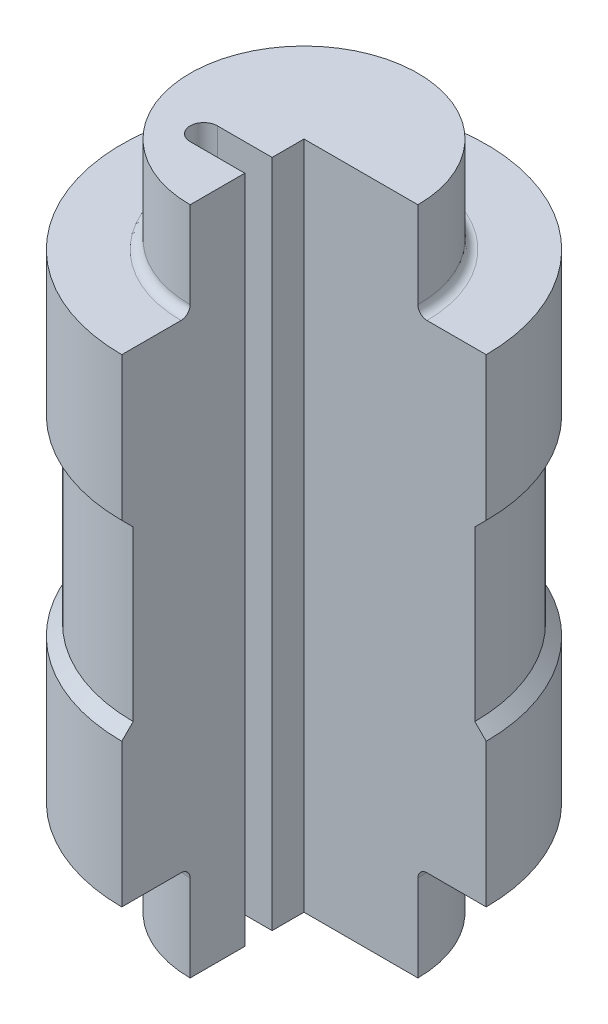
from build123d import *

# Parameters (mm, degrees)
SKETCH1_R           = 40
BOSS_EXTRUDE1_DEPTH = 105
SKETCH2_R           = 25
BOSS_EXTRUDE2_DEPTH = 21
BOSS_EXTRUDE3_START = 21
SKETCH3_R           = 25
BOSS_EXTRUDE3_DEPTH = 21
FILLET1_R           = 2
SKETCH5_W           = 44.625260544
SKETCH5_H           = 44.184879684
CUT_EXTRUDE1_DEPTH  = 158.508729917
CUT_EXTRUDE2_DEPTH  = 158.508729917


with BuildPart() as part:
    # Sketch1 → Boss-Extrude1 (new body)
    with BuildSketch(Plane(origin=(0, 0, 0), x_dir=(1, 0, 0), z_dir=(0, 1, 0))):
        with Locations(Location((0, 0, 0), (0, 0, 270))):
            Circle(SKETCH1_R)
    extrude(amount=BOSS_EXTRUDE1_DEPTH)

    # Sketch2 → Boss-Extrude2 (add)
    with BuildSketch(Plane(origin=(0, 105, 0), x_dir=(1, 0, 0), z_dir=(0, 1, 0))):
        with Locations(Location((0, 0, 0), (0, 0, 90))):
            Circle(SKETCH2_R)
    extrude(amount=BOSS_EXTRUDE2_DEPTH)

    # Sketch3 → Boss-Extrude3 (add)
    with BuildSketch(Plane(origin=(0, 0, 0), x_dir=(-1, 0, 0), z_dir=(0, -1, 0)).offset(BOSS_EXTRUDE3_START)):
        with Locations(Location((0, 0, 0), (0, 0, 90))):
            Circle(SKETCH3_R)
    extrude(amount=-BOSS_EXTRUDE3_DEPTH)

    # Fillet1
    fillet1_edges = [part.edges().sort_by_distance(p)[0] for p in [
        (0, 0, 25),
        (0, 105, 25),
    ]]
    fillet(fillet1_edges, radius=FILLET1_R)

    # Sketch4 → Cut-Revolve1 (revolve, cut)
    with BuildSketch(Plane(origin=(0, 0, 0), x_dir=(0, 0, -1), z_dir=(1, 0, 0)), mode=Mode.PRIVATE) as cut_revolve1_sk:
        Polygon((40, 73.5), (37.5, 71), (37.5, 34), (40, 31.5), align=None)
    revolve(cut_revolve1_sk.sketch.rotate(Axis((0, 105, 0), (0, -1, 0)), 180), axis=Axis((0, 105, 0), (0, -1, 0)), mode=Mode.SUBTRACT)

    # Sketch5 → Cut-Extrude1 (cut, through all)
    with BuildSketch(Plane(origin=(0, -21, 0), x_dir=(-1, 0, 0), z_dir=(0, -1, 0))):
        with Locations((-22.312630272, -22.092439842)):
            Rectangle(SKETCH5_W, SKETCH5_H)
    extrude(amount=-CUT_EXTRUDE1_DEPTH, mode=Mode.SUBTRACT)

    # Sketch7 → Cut-Extrude2 (cut, through all)
    with BuildSketch(Plane(origin=(0, -21, 0), x_dir=(-1, 0, 0), z_dir=(0, -1, 0))):
        with BuildLine():
            Line((12, -13), (-12, -13))
            ThreePointArc((-12, -13), (-15, -10), (-12, -7))
            Line((-12, -7), (12, -7))
            ThreePointArc((12, -7), (15, -10), (12, -13))
        make_face()
    extrude(amount=-CUT_EXTRUDE2_DEPTH, mode=Mode.SUBTRACT)


solid = part.part
